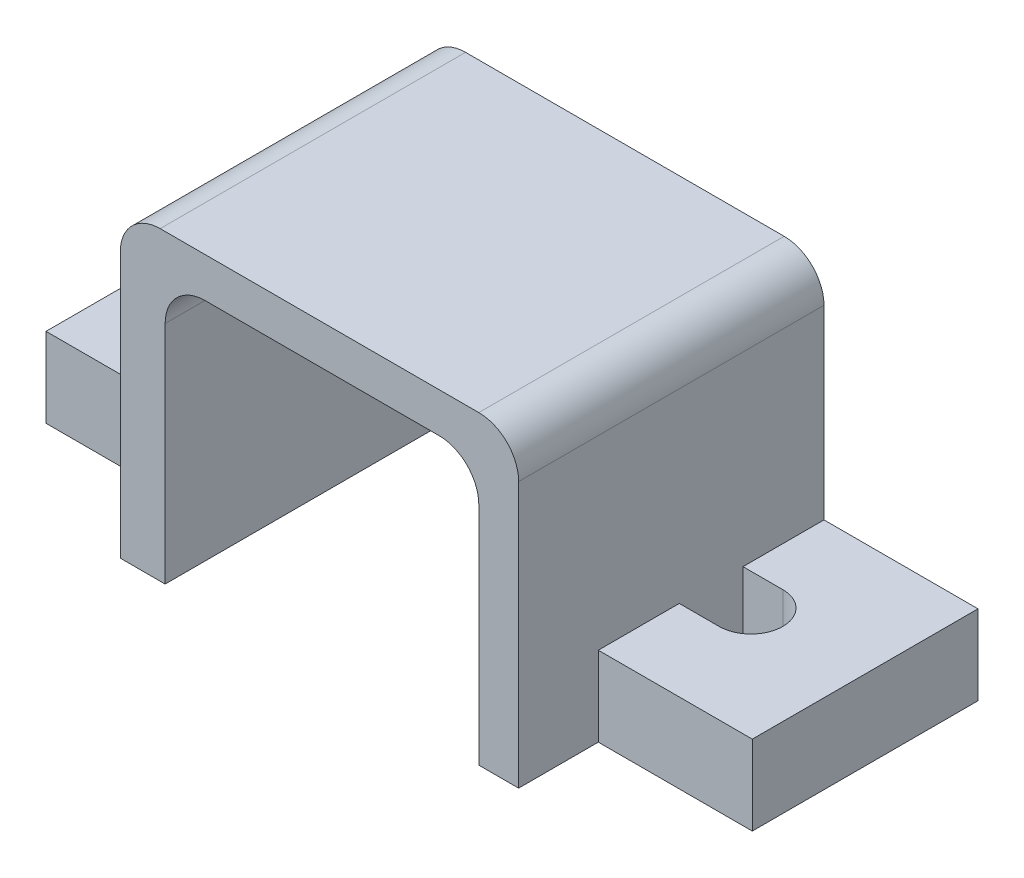
from build123d import *

# Parameters (mm, degrees)
EXTRUDE_1_DEPTH     = 11.5
SKETCH_3_W          = 11.812534662
SKETCH_3_H          = 10
CUT_EXTRUDE_1_DEPTH = 11.5
FILLET_1_R          = 1.5
FILLET_2_R          = 1.5
FILLET_3_R          = 1.5
FILLET_4_R          = 1.5
SKETCH_5_W          = 5.8
SKETCH_5_H          = 8.5
EXTRUDE_2_DEPTH     = 3
HOLE_WIZARD_M2_1_D  = 2.4
SKETCH_9_W          = 1.5
SKETCH_9_H          = 2.4
CUT_EXTRUDE_4_DEPTH = 3


with BuildPart() as part:
    # ｽｹｯﾁ1 → ﾎﾞｽ - 押し出し1 (new body)
    with BuildSketch(Plane.XY):
        Polygon((0, 0), (7.5, 0), (7.5, 11.5), (-7.5, 11.5), (-7.5, 0), align=None)
    extrude(amount=EXTRUDE_1_DEPTH)

    # ｽｹｯﾁ3 → ｶｯﾄ - 押し出し1 (cut)
    with BuildSketch(Plane.XY):
        with Locations((0.093732669, 5)):
            Rectangle(SKETCH_3_W, SKETCH_3_H)
    extrude(amount=CUT_EXTRUDE_1_DEPTH, mode=Mode.SUBTRACT)

    # ﾌｨﾚｯﾄ1
    fillet_1_edges = [part.edges().sort_by_distance(p)[0] for p in [
        (6, 10, 5.75),
    ]]
    fillet(fillet_1_edges, radius=FILLET_1_R)

    # ﾌｨﾚｯﾄ2
    fillet_2_edges = [part.edges().sort_by_distance(p)[0] for p in [
        (-5.812534662, 10, 5.75),
    ]]
    fillet(fillet_2_edges, radius=FILLET_2_R)

    # ﾌｨﾚｯﾄ3
    fillet_3_edges = [part.edges().sort_by_distance(p)[0] for p in [
        (7.5, 11.5, 5.75),
    ]]
    fillet(fillet_3_edges, radius=FILLET_3_R)

    # ﾌｨﾚｯﾄ4
    fillet_4_edges = [part.edges().sort_by_distance(p)[0] for p in [
        (-7.5, 11.5, 5.75),
    ]]
    fillet(fillet_4_edges, radius=FILLET_4_R)

    # ｽｹｯﾁ5 → ﾎﾞｽ - 押し出し2 (add)
    with BuildSketch(Plane(origin=(0, 0, 0), x_dir=(1, 0, 0), z_dir=(0, 1, 0))):
        with Locations((-10.4, -4.25)):
            Rectangle(SKETCH_5_W, SKETCH_5_H)
        with Locations((10.4, -4.25)):
            Rectangle(SKETCH_5_W, SKETCH_5_H)
    extrude(amount=EXTRUDE_2_DEPTH)

    # M2 すきま穴1 (through all)
    with Locations(Plane(origin=(0, 0, 0), x_dir=(-1, 0, 0), z_dir=(0, -1, 0))):
        with Locations((9, -4.25), (-9, -4.25)):
            Hole(HOLE_WIZARD_M2_1_D / 2)

    # ｽｹｯﾁ9 → ｶｯﾄ - 押し出し4 (cut)
    with BuildSketch(Plane(origin=(0, 0, 0), x_dir=(1, 0, 0), z_dir=(0, 1, 0))):
        with Locations((8.25, -4.25)):
            Rectangle(SKETCH_9_W, SKETCH_9_H)
        with Locations((-8.25, -4.25)):
            Rectangle(SKETCH_9_W, SKETCH_9_H)
    extrude(amount=CUT_EXTRUDE_4_DEPTH, mode=Mode.SUBTRACT)


solid = part.part
